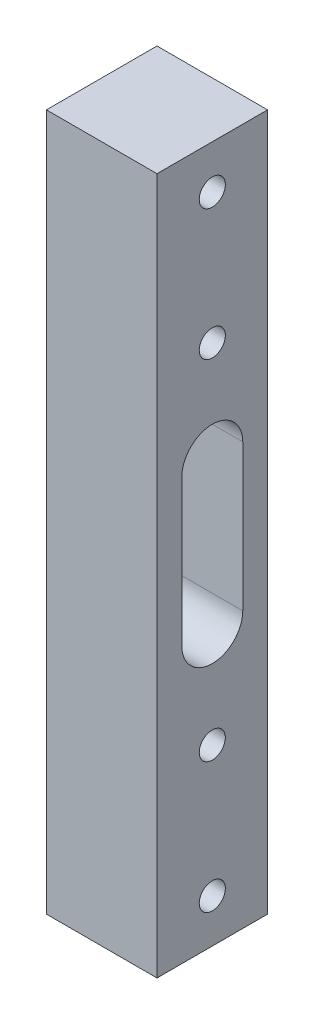
from build123d import *

# Parameters (mm, degrees)
SKETCH1_W           = 12.7
SKETCH1_H           = 80
SKETCH1_R           = 1.5
BOSS_EXTRUDE1_DEPTH = 12.7


with BuildPart() as part:
    # Sketch1 → Boss-Extrude1 (new body)
    with BuildSketch(Plane(origin=(293.136422298, 622.048865342, -296.053118138), x_dir=(0, 0, 1), z_dir=(-1, 0, 0))):
        with Locations((-165.577945174, 149.370143232)):
            Rectangle(SKETCH1_W, SKETCH1_H)
        with Locations(Location((-165.577945174, 169.370143232, 0), (0, 0, 270))):
            Circle(SKETCH1_R, mode=Mode.SUBTRACT)
        with Locations(Location((-165.577945174, 184.370143232, 0), (0, 0, 270))):
            Circle(SKETCH1_R, mode=Mode.SUBTRACT)
        with Locations(Location((-165.577945174, 114.370143232, 0), (0, 0, 270))):
            Circle(SKETCH1_R, mode=Mode.SUBTRACT)
        with Locations(Location((-165.577945174, 129.370143232, 0), (0, 0, 270))):
            Circle(SKETCH1_R, mode=Mode.SUBTRACT)
        with BuildLine():
            Line((-162.077945174, 157.77541555), (-162.077945174, 140.964870914))
            ThreePointArc((-162.077945174, 140.964870914), (-165.577945174, 137.464870914), (-169.077945174, 140.964870914))
            Line((-169.077945174, 140.964870914), (-169.077945174, 157.77541555))
            ThreePointArc((-169.077945174, 157.77541555), (-165.577945174, 161.27541555), (-162.077945174, 157.77541555))
        make_face(mode=Mode.SUBTRACT)
    extrude(amount=BOSS_EXTRUDE1_DEPTH)


solid = part.part
